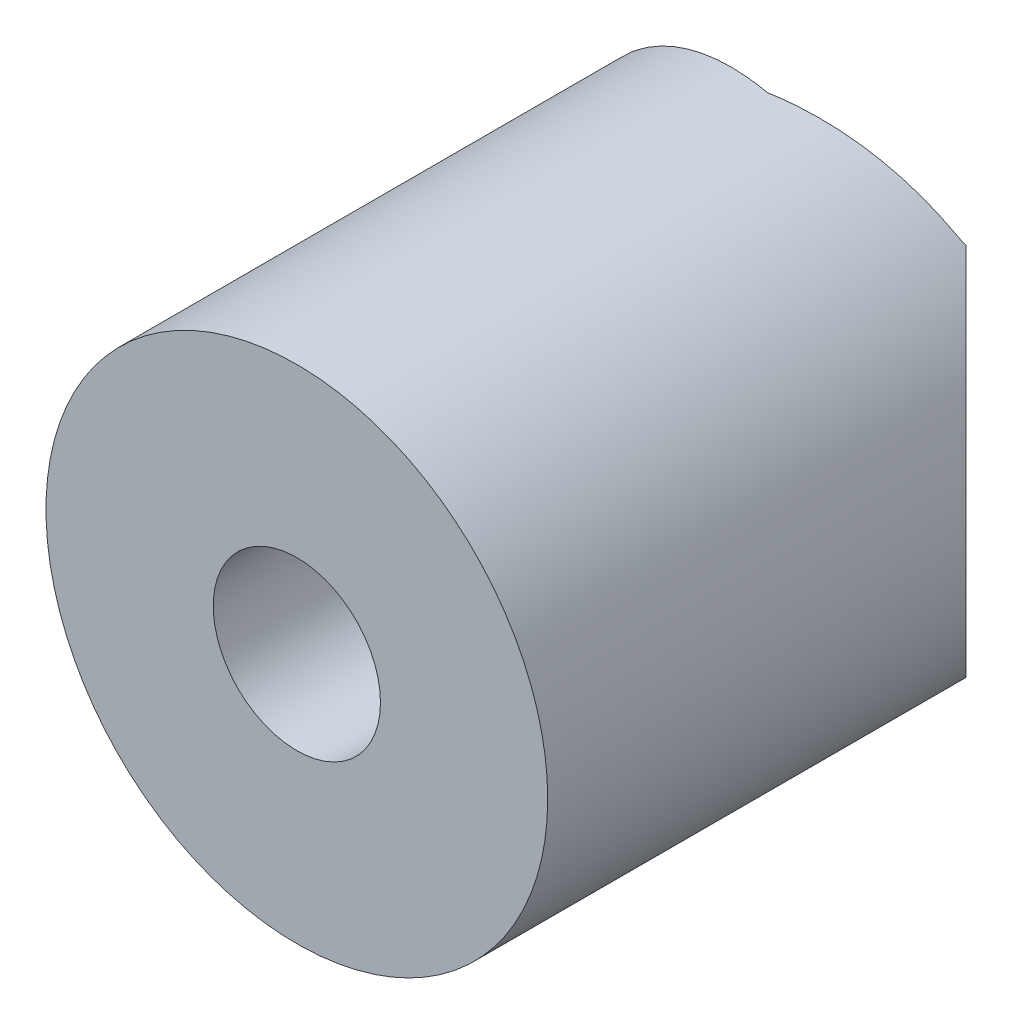
from build123d import *

# Parameters (mm, degrees)
SKETCH1_R               = 38.1
SKETCH1_R_2             = 12.7
BOSS_EXTRUDE1_DEPTH     = 76.2
CUT_EXTRUDE1_DEPTH      = 94.3255592
CUT_EXTRUDE1_DEPTH_BACK = 94.3255592


with BuildPart() as part:
    # Sketch1 → Boss-Extrude1 (new body)
    with BuildSketch(Plane.XY):
        Circle(SKETCH1_R)
        Circle(SKETCH1_R_2, mode=Mode.SUBTRACT)
    extrude(amount=-BOSS_EXTRUDE1_DEPTH)

    # Sketch2 → Cut-Extrude1 (cut, two sides: drawn at the far end of the back side and taken through both)
    with BuildSketch(Plane(origin=(0, 0, 0), x_dir=(1, 0, 0), z_dir=(0, 1, 0)).offset(-CUT_EXTRUDE1_DEPTH_BACK)):
        Polygon((-38.1, 76.2), (-25.4, 76.2), (-38.1, 63.5), align=None)
        with BuildLine():
            Line((0, 76.2), (-25.4, 76.2))
            ThreePointArc((-25.4, 76.2), (-24.878689197, 76.012385142), (-24.339821442, 75.883599159))
            Line((-24.339821442, 75.883599159), (0, 71.4756))
            Line((0, 71.4756), (0, 76.2))
        make_face()
        with BuildLine():
            Line((25.4, 76.2), (0, 76.2))
            Line((0, 76.2), (0, 71.4756))
            Line((0, 71.4756), (24.339821442, 75.883599159))
            ThreePointArc((24.339821442, 75.883599159), (24.878689197, 76.012385142), (25.4, 76.2))
        make_face()
        Polygon((38.1, 76.2), (25.4, 76.2), (38.1, 63.5), align=None)
    extrude(amount=CUT_EXTRUDE1_DEPTH + CUT_EXTRUDE1_DEPTH_BACK, mode=Mode.SUBTRACT)


solid = part.part
